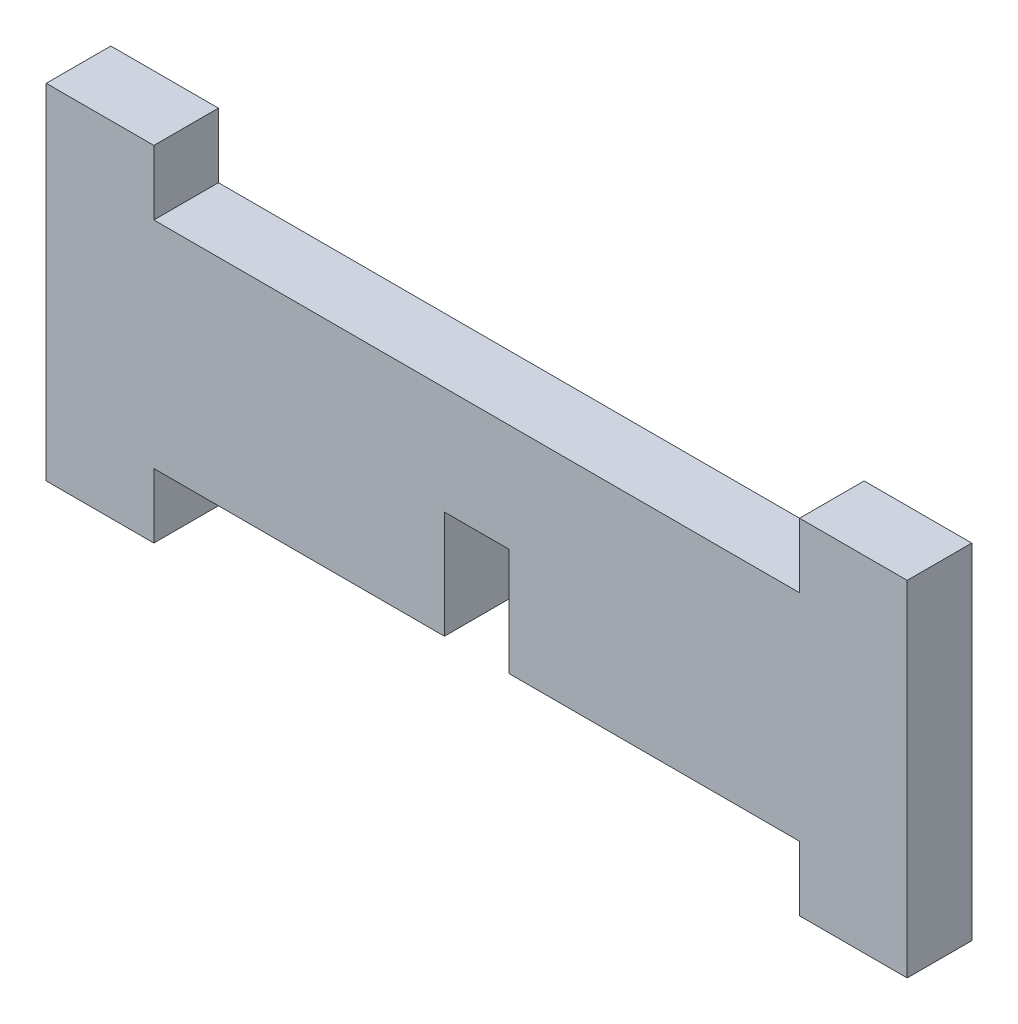
from build123d import *

# Parameters (mm, degrees)
SALIENTE_EXTRUIR1_DEPTH = 3


with BuildPart() as part:
    # Croquis1 → Saliente-Extruir1 (new body)
    with BuildSketch(Plane.XY):
        Polygon((-39.560439086, -10.485194585), (-39.560439086, -26.485194585), (-34.560439086, -26.485194585), (-34.560439086, -23.485194585), (-21.060439086, -23.485194585), (-21.060439086, -18.485194585), (-18.060439086, -18.485194585), (-18.060439086, -23.485194585), (-4.560439086, -23.485194585), (-4.560439086, -26.485194585), (0.439560914, -26.485194585), (0.439560914, -10.485194585), (-4.560439086, -10.485194585), (-4.560439086, -13.485194585), (-34.560439086, -13.485194585), (-34.560439086, -10.485194585), align=None)
    extrude(amount=SALIENTE_EXTRUIR1_DEPTH)


solid = part.part
